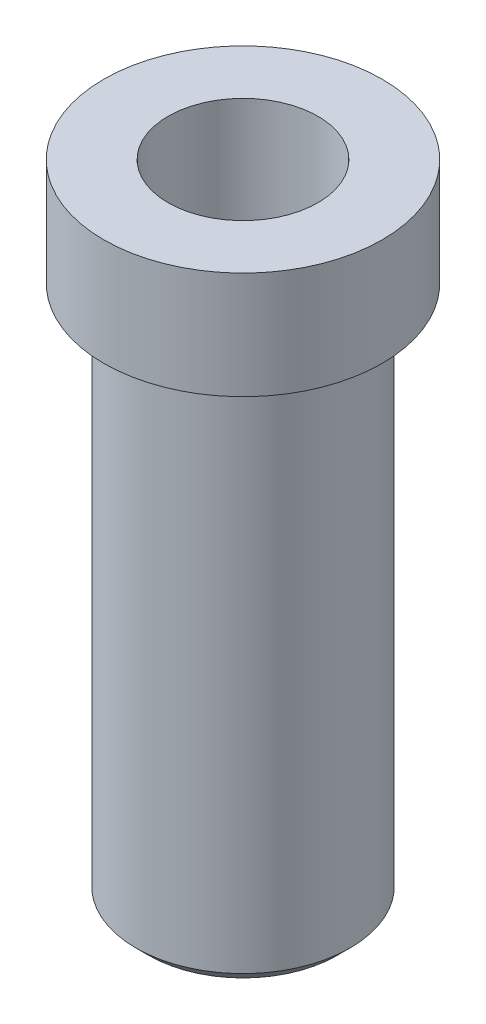
from build123d import *

# Parameters (mm, degrees)
CHAMFER1_SIZE = 0.06


with BuildPart() as part:
    # Sketch1 → Revolve1 (revolve)
    with BuildSketch(Plane.XY, mode=Mode.PRIVATE) as revolve1_sk:
        Polygon((0.65, 1.52980606), (0.35, 1.52980606), (0.35, -1.47019394), (0.5, -1.47019394), (0.5, 1.02980606), (0.65, 1.02980606), align=None)
    revolve(revolve1_sk.sketch.rotate(Axis((0, 1.52980606, 0), (0, -1, 0)), 90), axis=Axis((0, 1.52980606, 0), (0, -1, 0)))

    # Chamfer1
    chamfer1_edges = [part.edges().sort_by_distance(p)[0] for p in [
        (0, -1.47019394, -0.5),
    ]]
    chamfer(chamfer1_edges, length=CHAMFER1_SIZE)


solid = part.part
